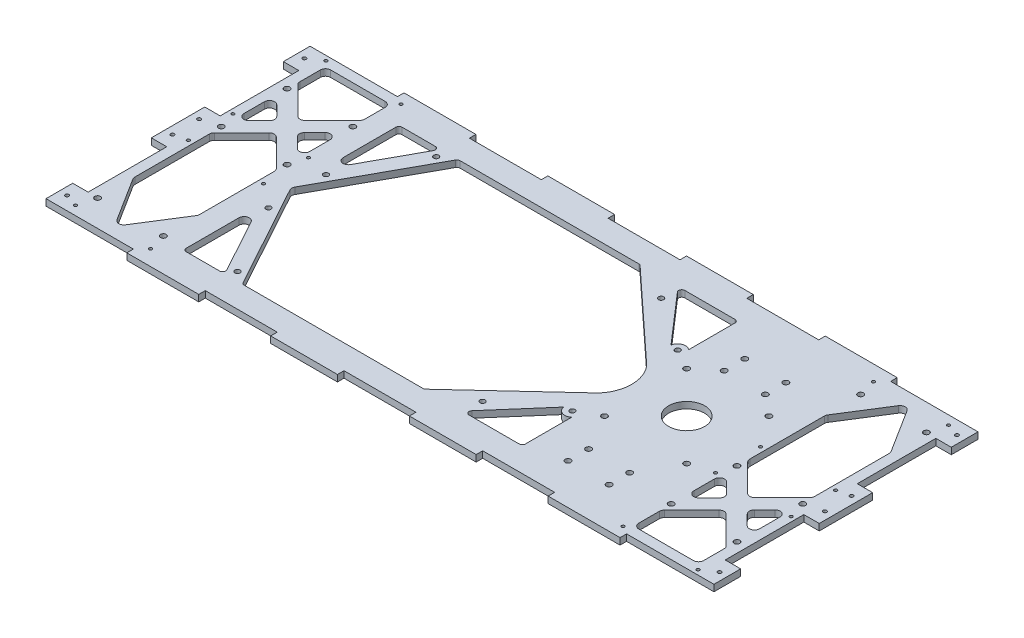
from build123d import *

# Parameters (mm, degrees)
SKETCH1_W           = 619.98
SKETCH1_H           = 269.7
BOSS_EXTRUDE1_DEPTH = 6.35
SKETCH3_R           = 2.75
CUT_EXTRUDE1_DEPTH  = 6.35
CUT_EXTRUDE2_DEPTH  = 6.35
SKETCH7_R           = 17.5
SKETCH7_R_2         = 2.75
CUT_EXTRUDE3_DEPTH  = 6.35
CUT_EXTRUDE4_DEPTH  = 6.35
SKETCH9_W           = 70
SKETCH9_H           = 6.36
CUT_EXTRUDE5_DEPTH  = 6.35
CUT_EXTRUDE6_DEPTH  = 10
BOSS_EXTRUDE2_DEPTH = 6.35
SKETCH14_R          = 7.5
SKETCH14_R_2        = 2.5
BOSS_EXTRUDE3_DEPTH = 6.35
SKETCH15_W          = 15
SKETCH15_H          = 26
SKETCH15_H_2        = 52
BOSS_EXTRUDE4_DEPTH = 6.35
SKETCH16_R          = 1.75
CUT_EXTRUDE7_DEPTH  = 25
SKETCH18_R          = 2.5
CUT_EXTRUDE8_DEPTH  = 25
SKETCH19_W          = 330
SKETCH19_H          = 16
BOSS_EXTRUDE5_DEPTH = 6.35
FILLET1_R           = 3
SKETCH20_R          = 1.5
CUT_EXTRUDE9_DEPTH  = 6.35


with BuildPart() as part:
    # Sketch1 → Boss-Extrude1 (new body)
    with BuildSketch(Plane(origin=(0, 0, 0), x_dir=(1, 0, 0), z_dir=(0, 1, 0))):
        Rectangle(SKETCH1_W, SKETCH1_H)
    extrude(amount=BOSS_EXTRUDE1_DEPTH)

    # Sketch3 → Cut-Extrude1 (cut)
    with BuildSketch(Plane(origin=(0, 6.35, 0), x_dir=(1, 0, 0), z_dir=(0, 1, 0))):
        with Locations(Location((-300.44, -102.85, 0), (0, 0, 270))):
            Circle(SKETCH3_R)
        with Locations(Location((-236.44, -102.85, 0), (0, 0, 270))):
            Circle(SKETCH3_R)
        with Locations(Location((-300.44, 17.52, 0), (0, 0, 270))):
            Circle(SKETCH3_R)
        with Locations(Location((-236.44, 17.52, 0), (0, 0, 270))):
            Circle(SKETCH3_R)
        with Locations(Location((-236.44, 81.52, 0), (0, 0, 270))):
            Circle(SKETCH3_R)
        with Locations(Location((-300.44, 81.52, 0), (0, 0, 270))):
            Circle(SKETCH3_R)
        with Locations(Location((300.44, 102.85, 0), (0, 0, 270))):
            Circle(SKETCH3_R)
        with Locations(Location((236.44, 102.85, 0), (0, 0, 270))):
            Circle(SKETCH3_R)
        with Locations(Location((300.44, -17.52, 0), (0, 0, 270))):
            Circle(SKETCH3_R)
        with Locations(Location((236.44, -17.52, 0), (0, 0, 270))):
            Circle(SKETCH3_R)
        with Locations(Location((236.44, -81.52, 0), (0, 0, 270))):
            Circle(SKETCH3_R)
        with Locations(Location((300.44, -81.52, 0), (0, 0, 270))):
            Circle(SKETCH3_R)
    extrude(amount=-CUT_EXTRUDE1_DEPTH, mode=Mode.SUBTRACT)

    # Sketch6 → Cut-Extrude2 (cut)
    with BuildSketch(Plane(origin=(0, 6.35, 0), x_dir=(1, 0, 0), z_dir=(0, 1, 0))):
        with BuildLine():
            Line((-299.218549437, -69.712584093), (-272.668549437, -111.788653824))
            ThreePointArc((-272.668549437, -111.788653824), (-268.44, -114.120439129), (-264.211450563, -111.788653824))
            Line((-264.211450563, -111.788653824), (-237.661450563, -69.712584093))
            ThreePointArc((-237.661450563, -69.712584093), (-237.086733029, -68.433119343), (-236.89, -67.044369398))
            Line((-236.89, -67.044369398), (-236.89, 5.448932188))
            ThreePointArc((-236.89, 5.448932188), (-237.270602337, 7.36234935), (-238.354466094, 8.984466094))
            Line((-238.354466094, 8.984466094), (-264.904466094, 35.534466094))
            ThreePointArc((-264.904466094, 35.534466094), (-268.44, 36.998932188), (-271.975533906, 35.534466094))
            Line((-271.975533906, 35.534466094), (-298.525533906, 8.984466094))
            ThreePointArc((-298.525533906, 8.984466094), (-299.609397663, 7.36234935), (-299.99, 5.448932188))
            Line((-299.99, 5.448932188), (-299.99, -67.044369398))
            ThreePointArc((-299.99, -67.044369398), (-299.793266971, -68.433119343), (-299.218549437, -69.712584093))
        make_face()
        with BuildLine():
            Line((-300.44, 59.448932188), (-300.44, 39.591067812))
            ThreePointArc((-300.44, 39.591067812), (-297.353417162, 34.971670149), (-291.904466094, 36.055533906))
            Line((-291.904466094, 36.055533906), (-281.975533906, 45.984466094))
            ThreePointArc((-281.975533906, 45.984466094), (-280.511067812, 49.52), (-281.975533906, 53.055533906))
            Line((-281.975533906, 53.055533906), (-291.904466094, 62.984466094))
            ThreePointArc((-291.904466094, 62.984466094), (-297.353417162, 64.068329851), (-300.44, 59.448932188))
        make_face()
        with BuildLine():
            Line((-254.904466094, 53.055533906), (-244.975533906, 62.984466094))
            ThreePointArc((-244.975533906, 62.984466094), (-239.526582838, 64.068329851), (-236.44, 59.448932188))
            Line((-236.44, 59.448932188), (-236.44, 39.591067812))
            ThreePointArc((-236.44, 39.591067812), (-239.526582838, 34.971670149), (-244.975533906, 36.055533906))
            Line((-244.975533906, 36.055533906), (-254.904466094, 45.984466094))
            ThreePointArc((-254.904466094, 45.984466094), (-256.368932188, 49.52), (-254.904466094, 53.055533906))
        make_face()
        with BuildLine():
            Line((-299.99, 113.49), (-299.99, 93.591067812))
            ThreePointArc((-299.99, 93.591067812), (-299.609397663, 91.67765065), (-298.525533906, 90.055533906))
            Line((-298.525533906, 90.055533906), (-271.975533906, 63.505533906))
            ThreePointArc((-271.975533906, 63.505533906), (-268.44, 62.041067812), (-264.904466094, 63.505533906))
            Line((-264.904466094, 63.505533906), (-238.354466094, 90.055533906))
            ThreePointArc((-238.354466094, 90.055533906), (-237.270602337, 91.67765065), (-236.89, 93.591067812))
            Line((-236.89, 93.591067812), (-236.89, 113.49))
            ThreePointArc((-236.89, 113.49), (-238.354466094, 117.025533906), (-241.89, 118.49))
            Line((-241.89, 118.49), (-294.99, 118.49))
            ThreePointArc((-294.99, 118.49), (-298.525533906, 117.025533906), (-299.99, 113.49))
        make_face()
        with BuildLine():
            Line((299.218549437, 69.712584093), (272.668549437, 111.788653824))
            ThreePointArc((272.668549437, 111.788653824), (268.44, 114.120439129), (264.211450563, 111.788653824))
            Line((264.211450563, 111.788653824), (237.661450563, 69.712584093))
            ThreePointArc((237.661450563, 69.712584093), (237.086733029, 68.433119343), (236.89, 67.044369398))
            Line((236.89, 67.044369398), (236.89, -5.448932188))
            ThreePointArc((236.89, -5.448932188), (237.270602337, -7.36234935), (238.354466094, -8.984466094))
            Line((238.354466094, -8.984466094), (264.904466094, -35.534466094))
            ThreePointArc((264.904466094, -35.534466094), (268.44, -36.998932188), (271.975533906, -35.534466094))
            Line((271.975533906, -35.534466094), (298.525533906, -8.984466094))
            ThreePointArc((298.525533906, -8.984466094), (299.609397663, -7.36234935), (299.99, -5.448932188))
            Line((299.99, -5.448932188), (299.99, 67.044369398))
            ThreePointArc((299.99, 67.044369398), (299.793266971, 68.433119343), (299.218549437, 69.712584093))
        make_face()
        with BuildLine():
            Line((300.44, -59.448932188), (300.44, -39.591067812))
            ThreePointArc((300.44, -39.591067812), (297.353417162, -34.971670149), (291.904466094, -36.055533906))
            Line((291.904466094, -36.055533906), (281.975533906, -45.984466094))
            ThreePointArc((281.975533906, -45.984466094), (280.511067812, -49.52), (281.975533906, -53.055533906))
            Line((281.975533906, -53.055533906), (291.904466094, -62.984466094))
            ThreePointArc((291.904466094, -62.984466094), (297.353417162, -64.068329851), (300.44, -59.448932188))
        make_face()
        with BuildLine():
            Line((254.904466094, -53.055533906), (244.975533906, -62.984466094))
            ThreePointArc((244.975533906, -62.984466094), (239.526582838, -64.068329851), (236.44, -59.448932188))
            Line((236.44, -59.448932188), (236.44, -39.591067812))
            ThreePointArc((236.44, -39.591067812), (239.526582838, -34.971670149), (244.975533906, -36.055533906))
            Line((244.975533906, -36.055533906), (254.904466094, -45.984466094))
            ThreePointArc((254.904466094, -45.984466094), (256.368932188, -49.52), (254.904466094, -53.055533906))
        make_face()
        with BuildLine():
            Line((299.99, -113.49), (299.99, -93.591067812))
            ThreePointArc((299.99, -93.591067812), (299.609397663, -91.67765065), (298.525533906, -90.055533906))
            Line((298.525533906, -90.055533906), (271.975533906, -63.505533906))
            ThreePointArc((271.975533906, -63.505533906), (268.44, -62.041067812), (264.904466094, -63.505533906))
            Line((264.904466094, -63.505533906), (238.354466094, -90.055533906))
            ThreePointArc((238.354466094, -90.055533906), (237.270602337, -91.67765065), (236.89, -93.591067812))
            Line((236.89, -93.591067812), (236.89, -113.49))
            ThreePointArc((236.89, -113.49), (238.354466094, -117.025533906), (241.89, -118.49))
            Line((241.89, -118.49), (294.99, -118.49))
            ThreePointArc((294.99, -118.49), (298.525533906, -117.025533906), (299.99, -113.49))
        make_face()
    extrude(amount=-CUT_EXTRUDE2_DEPTH, mode=Mode.SUBTRACT)

    # Sketch7 → Cut-Extrude3 (cut)
    with BuildSketch(Plane(origin=(0, 6.35, 0), x_dir=(1, 0, 0), z_dir=(0, 1, 0))):
        with Locations(Location((169.99, 0, 0), (0, 0, 270))):
            Circle(SKETCH7_R)
        with Locations(Location((129.99, 40, 0), (0, 0, 270))):
            Circle(SKETCH7_R_2)
        with Locations(Location((209.99, 40, 0), (0, 0, 270))):
            Circle(SKETCH7_R_2)
        with Locations(Location((209.99, -40, 0), (0, 0, 270))):
            Circle(SKETCH7_R_2)
        with Locations(Location((129.99, -40, 0), (0, 0, 270))):
            Circle(SKETCH7_R_2)
        with Locations(Location((149.99, 76.5, 0), (0, 0, 270))):
            Circle(SKETCH7_R_2)
        with Locations(Location((189.99, 76.5, 0), (0, 0, 270))):
            Circle(SKETCH7_R_2)
        with Locations(Location((189.99, 56.5, 0), (0, 0, 270))):
            Circle(SKETCH7_R_2)
        with Locations(Location((149.99, 56.5, 0), (0, 0, 270))):
            Circle(SKETCH7_R_2)
        with Locations(Location((149.99, -75.5, 0), (0, 0, 90))):
            Circle(SKETCH7_R_2)
        with Locations(Location((189.99, -75.5, 0), (0, 0, 90))):
            Circle(SKETCH7_R_2)
        with Locations(Location((189.99, -95.5, 0), (0, 0, 90))):
            Circle(SKETCH7_R_2)
        with Locations(Location((149.99, -95.5, 0), (0, 0, 90))):
            Circle(SKETCH7_R_2)
    extrude(amount=-CUT_EXTRUDE3_DEPTH, mode=Mode.SUBTRACT)

    # Sketch8 → Cut-Extrude4 (cut)
    with BuildSketch(Plane(origin=(0, 6.35, 0), x_dir=(1, 0, 0), z_dir=(0, 1, 0))):
        with BuildLine():
            Line((104.025499566, 15), (30, 15))
            ThreePointArc((30, 15), (26.464466094, 16.464466094), (25, 20))
            Line((25, 20), (25, 105.121099445))
            ThreePointArc((25, 105.121099445), (28.248479686, 109.804279624), (33.772870636, 108.402173532))
            Line((33.772870636, 108.402173532), (107.798370202, 23.281074087))
            ThreePointArc((107.798370202, 23.281074087), (108.575519919, 17.927003429), (104.025499566, 15))
        make_face()
        with BuildLine():
            Line((3.680812264, 2.404777768), (-58.576340239, 115.894777768))
            ThreePointArc((-58.576340239, 115.894777768), (-60.41289894, 117.79255092), (-62.960065126, 118.49))
            Line((-62.960065126, 118.49), (-147.039934874, 118.49))
            ThreePointArc((-147.039934874, 118.49), (-149.58710106, 117.79255092), (-151.423659761, 115.894777768))
            Line((-151.423659761, 115.894777768), (-213.680812264, 2.404777768))
            ThreePointArc((-213.680812264, 2.404777768), (-214.297087376, 0), (-213.680812264, -2.404777768))
            Line((-213.680812264, -2.404777768), (-151.423659761, -115.894777768))
            ThreePointArc((-151.423659761, -115.894777768), (-149.58710106, -117.79255092), (-147.039934874, -118.49))
            Line((-147.039934874, -118.49), (-62.960065126, -118.49))
            ThreePointArc((-62.960065126, -118.49), (-60.41289894, -117.79255092), (-58.576340239, -115.894777768))
            Line((-58.576340239, -115.894777768), (3.680812264, -2.404777768))
            ThreePointArc((3.680812264, -2.404777768), (4.297087376, 0), (3.680812264, 2.404777768))
        make_face()
        with BuildLine():
            Line((115, -51.227268886), (115, -113.49))
            ThreePointArc((115, -113.49), (113.535533906, -117.025533906), (110, -118.49))
            Line((110, -118.49), (55.853263115, -118.49))
            ThreePointArc((55.853263115, -118.49), (51.303242762, -115.562996571), (52.080392479, -110.208925913))
            Line((52.080392479, -110.208925913), (106.227129364, -47.9461948))
            ThreePointArc((106.227129364, -47.9461948), (111.751520314, -46.544088707), (115, -51.227268886))
        make_face()
        with BuildLine():
            Line((52.080392479, 110.208925913), (106.227129364, 47.9461948))
            ThreePointArc((106.227129364, 47.9461948), (111.751520314, 46.544088707), (115, 51.227268886))
            Line((115, 51.227268886), (115, 113.49))
            ThreePointArc((115, 113.49), (113.535533906, 117.025533906), (110, 118.49))
            Line((110, 118.49), (55.853263115, 118.49))
            ThreePointArc((55.853263115, 118.49), (51.303242762, 115.562996571), (52.080392479, 110.208925913))
        make_face()
        with BuildLine():
            Line((25, -20), (25, -105.121099445))
            ThreePointArc((25, -105.121099445), (28.248479686, -109.804279624), (33.772870636, -108.402173532))
            Line((33.772870636, -108.402173532), (107.798370202, -23.281074087))
            ThreePointArc((107.798370202, -23.281074087), (108.575519919, -17.927003429), (104.025499566, -15))
            Line((104.025499566, -15), (30, -15))
            ThreePointArc((30, -15), (26.464466094, -16.464466094), (25, -20))
        make_face()
        with BuildLine():
            Line((-34.445502007, 118.49), (0, 118.49))
            ThreePointArc((0, 118.49), (3.535533906, 117.025533906), (5, 113.49))
            Line((5, 113.49), (5, 50.698499496))
            ThreePointArc((5, 50.698499496), (1.241244449, 45.85501808), (-4.383724887, 48.293721728))
            Line((-4.383724887, 48.293721728), (-38.829226894, 111.085222232))
            ThreePointArc((-38.829226894, 111.085222232), (-38.748052927, 116.037166186), (-34.445502007, 118.49))
        make_face()
        with BuildLine():
            Line((-175.554497993, 118.49), (-210, 118.49))
            ThreePointArc((-210, 118.49), (-213.535533906, 117.025533906), (-215, 113.49))
            Line((-215, 113.49), (-215, 50.698499496))
            ThreePointArc((-215, 50.698499496), (-211.241244449, 45.85501808), (-205.616275113, 48.293721728))
            Line((-205.616275113, 48.293721728), (-171.170773106, 111.085222232))
            ThreePointArc((-171.170773106, 111.085222232), (-171.251947073, 116.037166186), (-175.554497993, 118.49))
        make_face()
        with BuildLine():
            Line((-205.616275113, -48.293721728), (-171.170773106, -111.085222232))
            ThreePointArc((-171.170773106, -111.085222232), (-171.251947073, -116.037166186), (-175.554497993, -118.49))
            Line((-175.554497993, -118.49), (-210, -118.49))
            ThreePointArc((-210, -118.49), (-213.535533906, -117.025533906), (-215, -113.49))
            Line((-215, -113.49), (-215, -50.698499496))
            ThreePointArc((-215, -50.698499496), (-211.241244449, -45.85501808), (-205.616275113, -48.293721728))
        make_face()
        with BuildLine():
            Line((5, -113.49), (5, -50.698499496))
            ThreePointArc((5, -50.698499496), (1.241244449, -45.85501808), (-4.383724887, -48.293721728))
            Line((-4.383724887, -48.293721728), (-38.829226894, -111.085222232))
            ThreePointArc((-38.829226894, -111.085222232), (-38.748052927, -116.037166186), (-34.445502007, -118.49))
            Line((-34.445502007, -118.49), (0, -118.49))
            ThreePointArc((0, -118.49), (3.535533906, -117.025533906), (5, -113.49))
        make_face()
    extrude(amount=-CUT_EXTRUDE4_DEPTH, mode=Mode.SUBTRACT)

    # Sketch9 → Cut-Extrude5 (cut)
    with BuildSketch(Plane(origin=(0, 6.35, 0), x_dir=(1, 0, 0), z_dir=(0, 1, 0))):
        with Locations((-274.99, -131.67)):
            Rectangle(SKETCH9_W, SKETCH9_H)
        with Locations((-134.99, -131.67)):
            Rectangle(SKETCH9_W, SKETCH9_H)
        with Locations((0, -131.67)):
            Rectangle(SKETCH9_W, SKETCH9_H)
        with Locations((274.99, -131.67)):
            Rectangle(SKETCH9_W, SKETCH9_H)
        with Locations((134.99, -131.67)):
            Rectangle(SKETCH9_W, SKETCH9_H)
    cut_extrude5 = extrude(amount=-CUT_EXTRUDE5_DEPTH, mode=Mode.SUBTRACT)

    # Mirror1: Cut-Extrude5 across plane
    add(cut_extrude5.mirror(Plane.XY), mode=Mode.SUBTRACT)

    # Sketch11 → Cut-Extrude6 (cut)
    with BuildSketch(Plane(origin=(0, 6.35, 0), x_dir=(1, 0, 0), z_dir=(0, 1, 0))):
        with BuildLine():
            Line((-70.645052416, 118.49), (25, 118.49))
            Line((25, 118.49), (107.798370202, 23.281074087))
            ThreePointArc((107.798370202, 23.281074087), (116.50554623, 0), (107.798370202, -23.281074087))
            Line((107.798370202, -23.281074087), (25, -118.49))
            Line((25, -118.49), (-70.645052416, -118.49))
            Line((-70.645052416, -118.49), (-70.645052416, 118.49))
        make_face()
    extrude(amount=-CUT_EXTRUDE6_DEPTH, mode=Mode.SUBTRACT)

    # Sketch12 → Boss-Extrude2 (add)
    with BuildSketch(Plane(origin=(0, 6.35, 0), x_dir=(1, 0, 0), z_dir=(0, 1, 0))):
        Polygon((5, -118.49), (107.798370202, -23.281074087), (25, -118.49), align=None)
        Polygon((107.798370202, 23.281074087), (25, 118.49), (5, 118.49), align=None)
    extrude(amount=-BOSS_EXTRUDE2_DEPTH)

    # Sketch14 → Boss-Extrude3 (add)
    # profile 1 of 2: a face of its own
    with BuildSketch(Plane(origin=(0, 6.35, 0), x_dir=(1, 0, 0), z_dir=(0, 1, 0))):
        with Locations((110, 51.227268886)):
            Circle(SKETCH14_R)
        with Locations(Location((110, 51.227268886, 0), (0, 0, 270))):
            Circle(SKETCH14_R_2, mode=Mode.SUBTRACT)
    # profile 2 of 2: a face of its own
    with BuildSketch(Plane(origin=(0, 6.35, 0), x_dir=(1, 0, 0), z_dir=(0, 1, 0))):
        with Locations((110, -51.227268886)):
            Circle(SKETCH14_R)
        with Locations(Location((110, -51.227268886, 0), (0, 0, 270))):
            Circle(SKETCH14_R_2, mode=Mode.SUBTRACT)
    extrude(amount=-BOSS_EXTRUDE3_DEPTH)

    # Sketch15 → Boss-Extrude4 (add)
    with BuildSketch(Plane(origin=(0, 6.35, 0), x_dir=(1, 0, 0), z_dir=(0, 1, 0))):
        with Locations((-317.49, -115.49)):
            Rectangle(SKETCH15_W, SKETCH15_H)
        with Locations((-317.49, 0)):
            Rectangle(SKETCH15_W, SKETCH15_H_2)
        with Locations((-317.49, 115.49)):
            Rectangle(SKETCH15_W, SKETCH15_H)
    boss_extrude4 = extrude(amount=-BOSS_EXTRUDE4_DEPTH)

    # Sketch16 → Cut-Extrude7 (cut)
    with BuildSketch(Plane(origin=(0, 6.35, 0), x_dir=(1, 0, 0), z_dir=(0, 1, 0))):
        with Locations(Location((-317.49, 115.49, 0), (0, 0, 270))):
            Circle(SKETCH16_R)
        with Locations(Location((-317.49, 13, 0), (0, 0, 270))):
            Circle(SKETCH16_R)
        with Locations(Location((-317.49, -13, 0), (0, 0, 270))):
            Circle(SKETCH16_R)
        with Locations(Location((-317.49, -115.49, 0), (0, 0, 270))):
            Circle(SKETCH16_R)
    cut_extrude7 = extrude(amount=-CUT_EXTRUDE7_DEPTH, mode=Mode.SUBTRACT)

    # Mirror2: Boss-Extrude4, Cut-Extrude7 across plane
    add(boss_extrude4.mirror(Plane(origin=(0, 0, 0), x_dir=(0, 0, 1), z_dir=(1, 0, 0))))
    add(cut_extrude7.mirror(Plane(origin=(0, 0, 0), x_dir=(0, 0, 1), z_dir=(1, 0, 0))), mode=Mode.SUBTRACT)

    # Sketch18 → Cut-Extrude8 (cut)
    with BuildSketch(Plane(origin=(0, 6.35, 0), x_dir=(1, 0, 0), z_dir=(0, 1, 0))):
        with Locations(Location((-170.496673375, 96.720097646, 0), (0, 0, 270))):
            Circle(SKETCH18_R)
        with Locations(Location((-170.496673375, -96.720097646, 0), (0, 0, 270))):
            Circle(SKETCH18_R)
        with Locations(Location((58.250305155, -86.890200299, 0), (0, 0, 270))):
            Circle(SKETCH18_R)
        with Locations(Location((58.250305155, 86.890200299, 0), (0, 0, 270))):
            Circle(SKETCH18_R)
        with Locations(Location((-209, 28, 0), (0, 0, 270))):
            Circle(SKETCH18_R)
        with Locations(Location((-209, -28, 0), (0, 0, 270))):
            Circle(SKETCH18_R)
    extrude(amount=-CUT_EXTRUDE8_DEPTH, mode=Mode.SUBTRACT)

    # Sketch19 → Boss-Extrude5 (add)
    with BuildSketch(Plane(origin=(0, 6.35, 0), x_dir=(1, 0, 0), z_dir=(0, 1, 0))):
        with Locations((-50, -113)):
            Rectangle(SKETCH19_W, SKETCH19_H)
        with Locations((-50, 113)):
            Rectangle(SKETCH19_W, SKETCH19_H)
    extrude(amount=-BOSS_EXTRUDE5_DEPTH)

    # Fillet1
    fillet1_edges = [part.edges().sort_by_distance(p)[0] for p in [
        (19.565336188, 3.175, 105),
        (-215, 3.175, 105),
        (56.610330948, 3.175, 105),
        (115, 3.175, 105),
        (-174.50894042, 3.175, 105),
        (-157.400202549, 3.175, 105),
        (19.565336188, 3.175, -105),
        (115, 3.175, -105),
        (56.610330948, 3.175, -105),
        (-215, 3.175, -105),
        (-174.50894042, 3.175, -105),
        (-157.400202549, 3.175, -105),
    ]]
    fillet(fillet1_edges, radius=FILLET1_R)

    # Sketch20 → Cut-Extrude9 (cut)
    with BuildSketch(Plane(origin=(0, 0, 0), x_dir=(-1, 0, 0), z_dir=(0, -1, 0))):
        with Locations(Location((-304.99, 119.85, 0), (0, 0, 90))):
            Circle(SKETCH20_R)
        with Locations(Location((-231.89, 119.85, 0), (0, 0, 90))):
            Circle(SKETCH20_R)
        with Locations(Location((-304.99, 10, 0), (0, 0, 90))):
            Circle(SKETCH20_R)
        with Locations(Location((-231.89, 10, 0), (0, 0, 90))):
            Circle(SKETCH20_R)
        with Locations(Location((-305.44, -33.85, 0), (0, 0, 90))):
            Circle(SKETCH20_R)
        with Locations(Location((-231.89, -33.85, 0), (0, 0, 90))):
            Circle(SKETCH20_R)
        with Locations(Location((-304.99, -123.85, 0), (0, 0, 90))):
            Circle(SKETCH20_R)
        with Locations(Location((-232.022169564, -123.965665677, 0), (0, 0, 90))):
            Circle(SKETCH20_R)
        with Locations(Location((231.89, -119.85, 0), (0, 0, 90))):
            Circle(SKETCH20_R)
        with Locations(Location((304.99, -119.85, 0), (0, 0, 90))):
            Circle(SKETCH20_R)
        with Locations(Location((304.99, -10, 0), (0, 0, 90))):
            Circle(SKETCH20_R)
        with Locations(Location((231.89, -10, 0), (0, 0, 90))):
            Circle(SKETCH20_R)
        with Locations(Location((231.89, 33.85, 0), (0, 0, 90))):
            Circle(SKETCH20_R)
        with Locations(Location((305.44, 33.85, 0), (0, 0, 90))):
            Circle(SKETCH20_R)
        with Locations(Location((304.99, 123.85, 0), (0, 0, 90))):
            Circle(SKETCH20_R)
        with Locations(Location((231.89, 123.85, 0), (0, 0, 90))):
            Circle(SKETCH20_R)
    extrude(amount=-CUT_EXTRUDE9_DEPTH, mode=Mode.SUBTRACT)


solid = part.part
